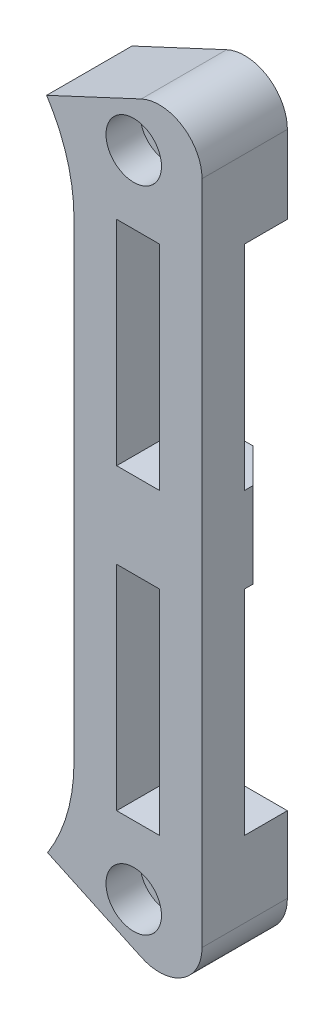
from build123d import *

# Parameters (mm, degrees)
ESQUISSE1_R             = 2
BOSS_EXTRU_1_DEPTH      = 10
CONG_1_R                = 5
ESQUISSE2_W             = 5
ESQUISSE2_H             = 60
ENL_V_MAT_EXTRU_1_DEPTH = 10
ESQUISSE3_W             = 5
ESQUISSE3_H             = 60
ENL_V_MAT_EXTRU_2_DEPTH = 10
CHANFREIN1_SIZE         = 2
ESQUISSE4_R             = 3.25
ENL_V_MAT_EXTRU_3_DEPTH = 4
ESQUISSE5_W             = 10
ESQUISSE5_H             = 10
BOSS_EXTRU_2_DEPTH      = 14
CHANFREIN2_SIZE         = 4


with BuildPart() as part:
    # Esquisse1 → Boss.-Extru.1 (new body)
    with BuildSketch(Plane.XY):
        with BuildLine():
            Line((-18.204033367, 85.222112705), (0, 93.710792873))
            Line((0, 93.710792873), (0, 0))
            Line((0, 0), (-18.090380717, 8.435683067))
            ThreePointArc((-18.090380717, 8.435683067), (-15.788123652, 13.556675009), (-15, 19.11579429))
            Line((-15, 19.11579429), (-15, 74.36205738))
            ThreePointArc((-15, 74.36205738), (-15.817430029, 80.02356101), (-18.204033367, 85.222112705))
        make_face()
        with Locations((-8, 8.738925835)):
            Circle(ESQUISSE1_R, mode=Mode.SUBTRACT)
        with Locations((-8, 84.738925835)):
            Circle(ESQUISSE1_R, mode=Mode.SUBTRACT)
    extrude(amount=BOSS_EXTRU_1_DEPTH)

    # Congé1
    cong_1_edges = [part.edges().sort_by_distance(p)[0] for p in [
        (0, 0, 5),
        (0, 93.710792873, 5),
    ]]
    fillet(cong_1_edges, radius=CONG_1_R)

    # Esquisse2 → Enlèv. mat.-Extru.1 (cut)
    with BuildSketch(Plane(origin=(0, 0, 0), x_dir=(0, 0, -1), z_dir=(1, 0, 0))):
        with Locations((-2.5, 46.738925835)):
            Rectangle(ESQUISSE2_W, ESQUISSE2_H)
    extrude(amount=-ENL_V_MAT_EXTRU_1_DEPTH, mode=Mode.SUBTRACT)

    # Esquisse3 → Enlèv. mat.-Extru.2 (cut)
    with BuildSketch(Plane(origin=(0, 0, 5), x_dir=(-1, 0, 0), z_dir=(0, 0, -1))):
        with Locations((7.5, 46.738925835)):
            Rectangle(ESQUISSE3_W, ESQUISSE3_H)
    extrude(amount=-ENL_V_MAT_EXTRU_2_DEPTH, mode=Mode.SUBTRACT)

    # Chanfrein1
    chanfrein1_edges = [part.edges().sort_by_distance(p)[0] for p in [
        (-5, 46.738925835, 5),
    ]]
    chamfer(chanfrein1_edges, length=CHANFREIN1_SIZE)

    # Esquisse4 → Enlèv. mat.-Extru.3 (cut)
    with BuildSketch(Plane.XY.offset(10)):
        with Locations((-8, 84.738925835)):
            Circle(ESQUISSE4_R)
        with Locations((-8, 8.738925835)):
            Circle(ESQUISSE4_R)
    extrude(amount=-ENL_V_MAT_EXTRU_3_DEPTH, mode=Mode.SUBTRACT)

    # Esquisse5 → Boss.-Extru.2 (add)
    with BuildSketch(Plane(origin=(0, 0, 0), x_dir=(0, 0, -1), z_dir=(1, 0, 0))):
        with Locations((-5, 46.738925835)):
            Rectangle(ESQUISSE5_W, ESQUISSE5_H)
    extrude(amount=-BOSS_EXTRU_2_DEPTH)

    # Chanfrein2
    chanfrein2_edges = [part.edges().sort_by_distance(p)[0] for p in [
        (0, 46.738925835, 0),
    ]]
    chamfer(chanfrein2_edges, length=CHANFREIN2_SIZE)


solid = part.part
